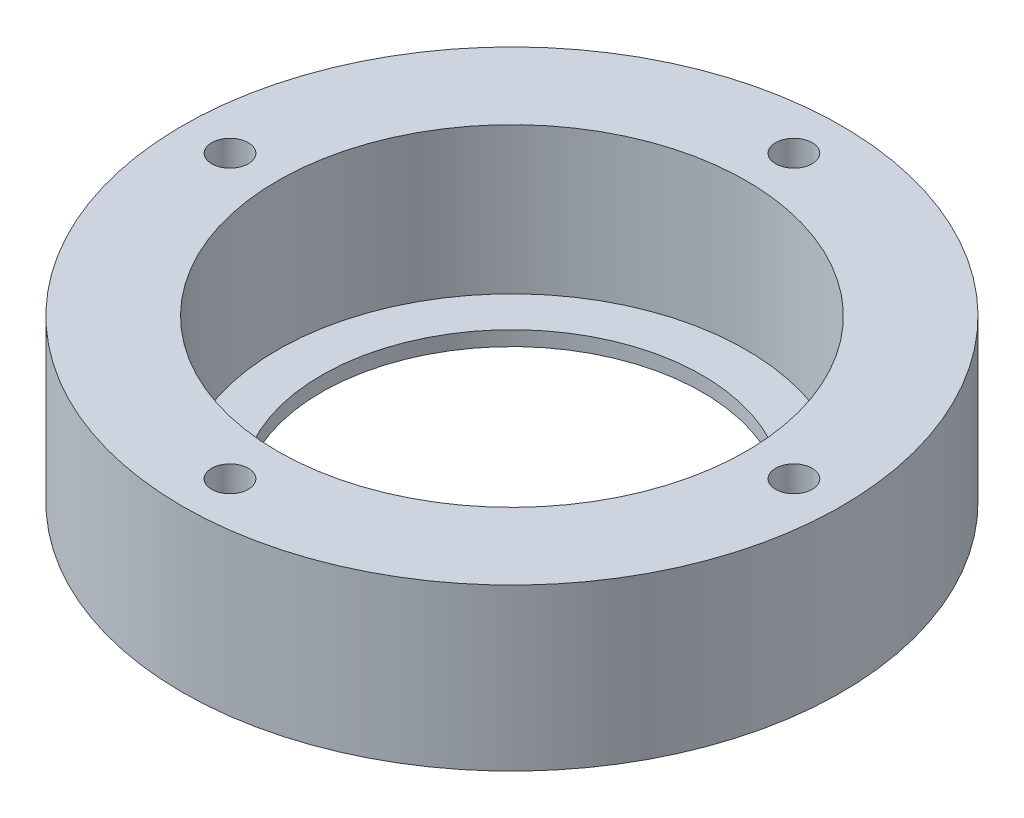
from build123d import *

# Parameters (mm, degrees)
SKETCH_1_R          = 22.5
EXTRUDE_1_DEPTH     = 11
SKETCH_2_R          = 16
CUT_EXTRUDE_1_DEPTH = 10
SKETCH_3_R          = 13
CUT_EXTRUDE_2_DEPTH = 34.35416016
M3X0_51_D           = 2.5
M3X0_51_DEPTH       = 8.5
M3X0_51_TIP         = 0.751075774


with BuildPart() as part:
    # Эскиз1 → Бобышка-Вытянуть1 (new body)
    with BuildSketch(Plane(origin=(0, 0, 0), x_dir=(1, 0, 0), z_dir=(0, 1, 0))):
        with Locations(Location((0, 0, 0), (0, 0, 270))):
            Circle(SKETCH_1_R)
    extrude(amount=EXTRUDE_1_DEPTH)

    # Эскиз2 → Вырез-Вытянуть1 (cut)
    with BuildSketch(Plane(origin=(0, 11, 0), x_dir=(1, 0, 0), z_dir=(0, 1, 0))):
        with Locations(Location((0, 0, 0), (0, 0, 270))):
            Circle(SKETCH_2_R)
    extrude(amount=-CUT_EXTRUDE_1_DEPTH, mode=Mode.SUBTRACT)

    # Эскиз3 → Вырез-Вытянуть2 (cut, through all)
    with BuildSketch(Plane(origin=(0, 1, 0), x_dir=(1, 0, 0), z_dir=(0, 1, 0))):
        with Locations(Location((0, 0, 0), (0, 0, 270))):
            Circle(SKETCH_3_R)
    extrude(amount=-CUT_EXTRUDE_2_DEPTH, mode=Mode.SUBTRACT)

    # Отверстие обработанное метчиком M3x0.51
    with Locations(Plane(origin=(0, 11, 0), x_dir=(1, 0, 0), z_dir=(0, 1, 0))):
        with Locations((-19.25, 0), (0, -19.25), (19.25, 0), (0, 19.25)):
            Hole(M3X0_51_D / 2, depth=M3X0_51_DEPTH)
            with Locations((0, 0, -(M3X0_51_DEPTH + M3X0_51_TIP / 2))):  # 118° drill point
                Cone(0, M3X0_51_D / 2, M3X0_51_TIP, mode=Mode.SUBTRACT)


solid = part.part
